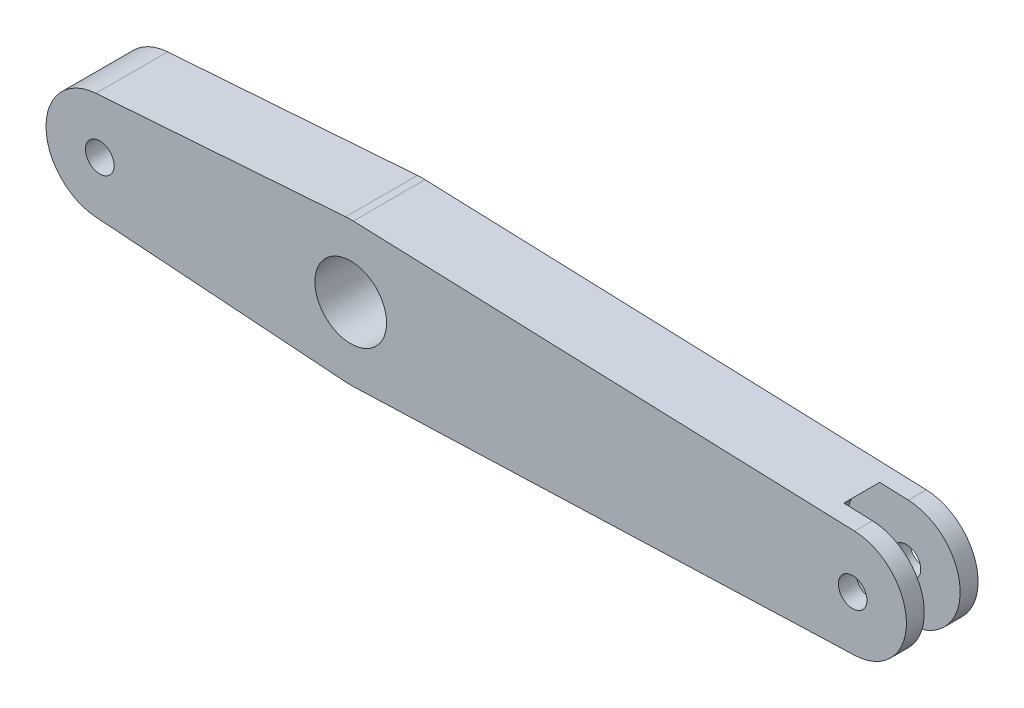
from build123d import *

# Parameters (mm, degrees)
SKETCH_1_R          = 10
SKETCH_1_R_2        = 4
EXTRUDE_1_DEPTH     = 20
CUT_EXTRUDE_START   = 5
SKETCH_2_R          = 17
CUT_EXTRUDE_1_DEPTH = 10


with BuildPart() as part:
    # 草图1 → 凸台-拉伸1 (new body)
    with BuildSketch(Plane.XY):
        with BuildLine():
            Line((-71.071428571, 14.961685761), (-1.428571429, 19.948914348))
            ThreePointArc((-1.428571429, 19.948914348), (-0.357656609, 19.996801788), (0.714285714, 19.987240828))
            Line((0.714285714, 19.987240828), (140.535714286, 14.990430621))
            ThreePointArc((140.535714286, 14.990430621), (155, 0), (140.535714286, -14.990430621))
            Line((140.535714286, -14.990430621), (0.714285714, -19.987240828))
            ThreePointArc((0.714285714, -19.987240828), (-0.357656609, -19.996801788), (-1.428571429, -19.948914348))
            Line((-1.428571429, -19.948914348), (-71.071428571, -14.961685761))
            ThreePointArc((-71.071428571, -14.961685761), (-85, 0), (-71.071428571, 14.961685761))
        make_face()
        Circle(SKETCH_1_R, mode=Mode.SUBTRACT)
        with Locations((-70, 0)):
            Circle(SKETCH_1_R_2, mode=Mode.SUBTRACT)
        with Locations((140, 0)):
            Circle(SKETCH_1_R_2, mode=Mode.SUBTRACT)
    extrude(amount=EXTRUDE_1_DEPTH)

    # 草图2 → 切除-拉伸1 (cut)
    with BuildSketch(Plane.XY.offset(CUT_EXTRUDE_START)):
        with Locations((140, 0)):
            Circle(SKETCH_2_R)
    extrude(amount=CUT_EXTRUDE_1_DEPTH, mode=Mode.SUBTRACT)


solid = part.part
